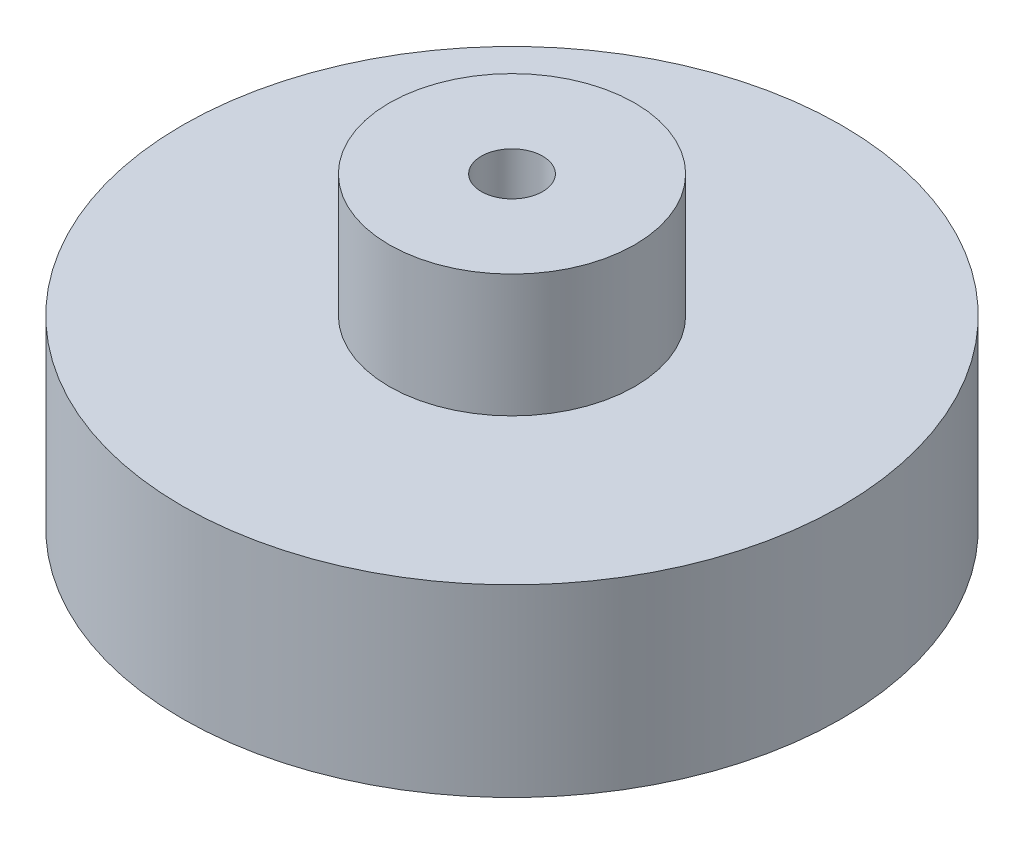
from build123d import *

# Parameters (mm, degrees)
SKETCH_1_R          = 26.85
EXTRUDE_1_DEPTH     = 15
SKETCH_3_R          = 10
EXTRUDE_2_DEPTH     = 10
SKETCH_2_R          = 2.5
CUT_EXTRUDE_1_DEPTH = 46.462567019


with BuildPart() as part:
    # 스케치1 → 보스-돌출1 (new body)
    with BuildSketch(Plane(origin=(0, 0, 0), x_dir=(1, 0, 0), z_dir=(0, 1, 0))):
        with Locations(Location((0, 0, 0), (0, 0, 270))):
            Circle(SKETCH_1_R)
    extrude(amount=EXTRUDE_1_DEPTH)

    # 스케치3 → 보스-돌출2 (add)
    with BuildSketch(Plane(origin=(0, 15, 0), x_dir=(1, 0, 0), z_dir=(0, 1, 0))):
        with Locations(Location((0, 0, 0), (0, 0, 270))):
            Circle(SKETCH_3_R)
    extrude(amount=EXTRUDE_2_DEPTH)

    # 스케치2 → 컷-돌출1 (cut, through all)
    with BuildSketch(Plane.XZ):
        with Locations(Location((0, 0, 0), (0, 0, 270))):
            Circle(SKETCH_2_R)
    extrude(amount=-CUT_EXTRUDE_1_DEPTH, mode=Mode.SUBTRACT)


solid = part.part
